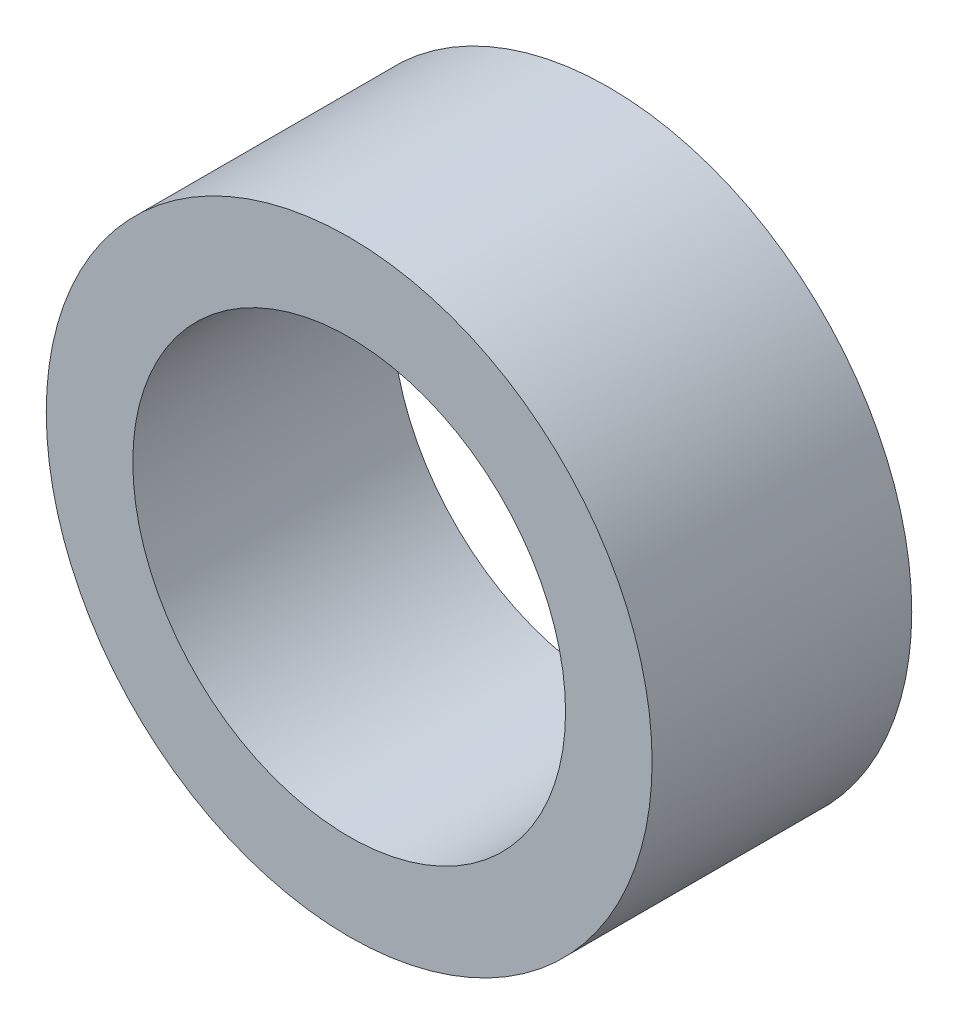
from build123d import *

# Parameters (mm, degrees)
SKETCH_1_R      = 3.5
SKETCH_1_R_2    = 2.5
EXTRUDE_1_DEPTH = 3


with BuildPart() as part:
    # 草图1 → 凸台-拉伸1 (new body)
    with BuildSketch(Plane.XY):
        Circle(SKETCH_1_R)
        Circle(SKETCH_1_R_2, mode=Mode.SUBTRACT)
    extrude(amount=EXTRUDE_1_DEPTH)


solid = part.part
